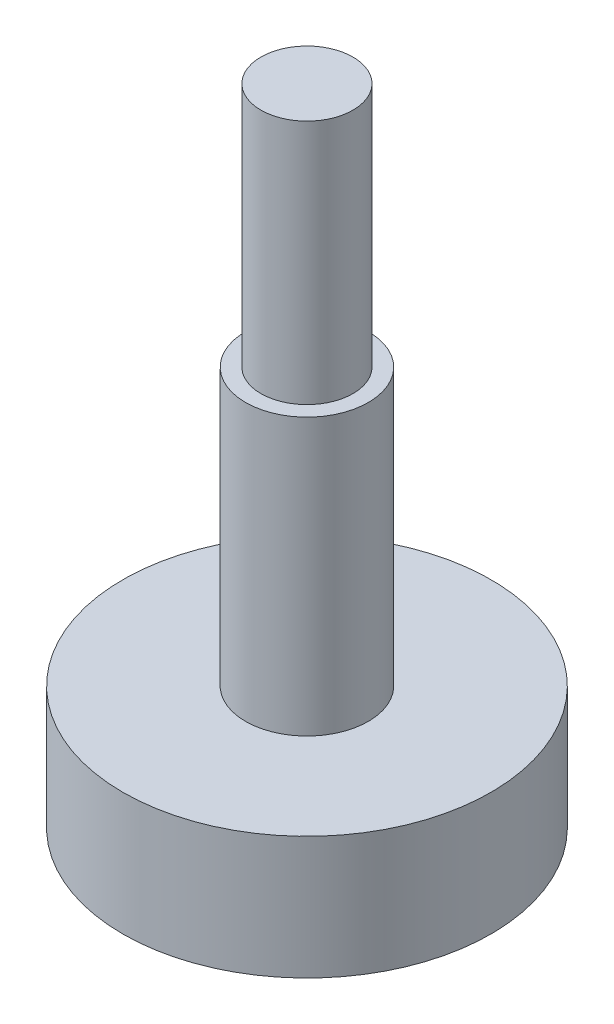
from build123d import *

# Parameters (mm, degrees)
CUT_EXTRUDE1_DEPTH = 2


with BuildPart() as part:
    # Sketch1 → Revolve1 (revolve)
    with BuildSketch(Plane.XY, mode=Mode.PRIVATE) as revolve1_sk:
        Polygon((0, 0), (6, 0), (6, 4), (2, 4), (2, 13), (1.5, 13), (1.5, 21), (0, 21), align=None)
    revolve(revolve1_sk.sketch.rotate(Axis((0, 21, 0), (0, -1, 0)), 90), axis=Axis((0, 21, 0), (0, -1, 0)))

    # Sketch2 → Cut-Extrude1 (cut)
    with BuildSketch(Plane.XZ):
        Polygon((0, -1.732050808), (1.5, -0.866025404), (1.5, 0.866025404), (0, 1.732050808), (-1.5, 0.866025404), (-1.5, -0.866025404), align=None)
    extrude(amount=-CUT_EXTRUDE1_DEPTH, mode=Mode.SUBTRACT)


solid = part.part
